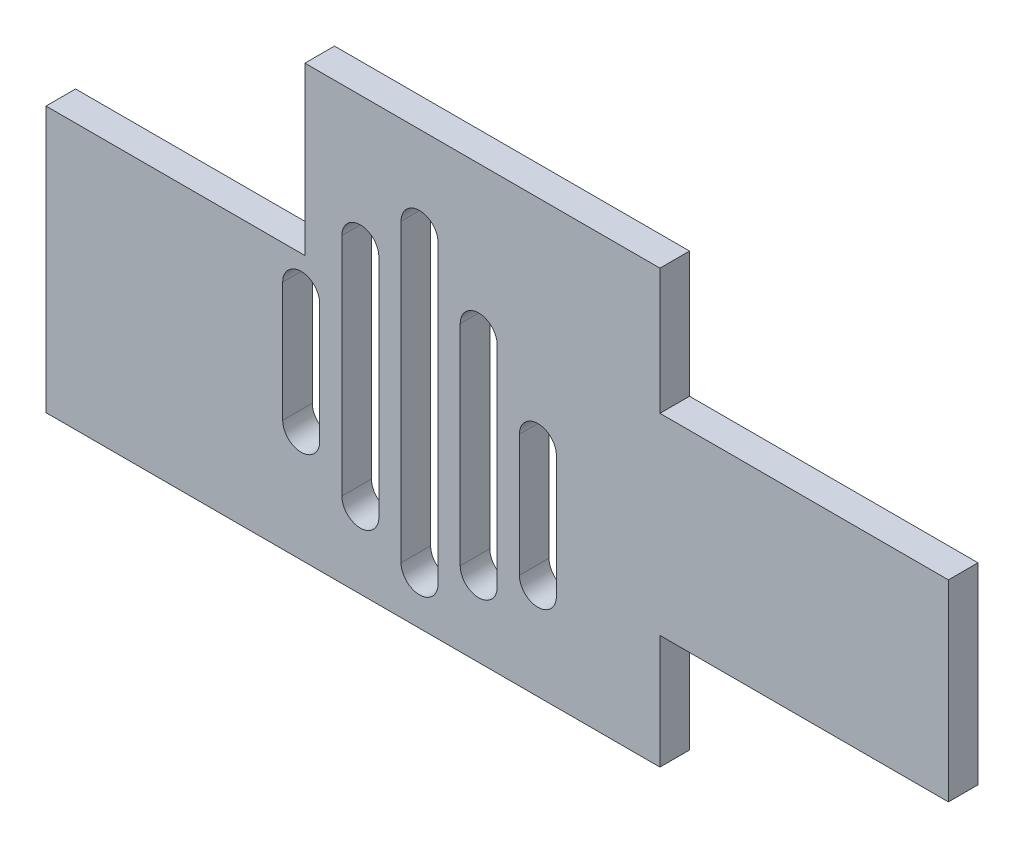
from build123d import *

# Parameters (mm, degrees)
BOSS_EXTRUDE1_DEPTH = 4


with BuildPart() as part:
    # Sketch1 → Boss-Extrude1 (new body)
    with BuildSketch(Plane.XY):
        Polygon((30.862718171, 33.994054131), (69.862718171, 33.994054131), (69.862718171, 7.994054131), (30.862718171, 7.994054131), (30.862718171, -7.430851064), (-52.137281829, -7.430851064), (-52.137281829, 28.472304637), (-17.137281829, 28.472304637), (-17.137281829, 50.994054131), (30.862718171, 50.994054131), align=None)
        with BuildLine():
            Line((-4.137281829, 38.994054131), (-4.137281829, -1.005945869))
            ThreePointArc((-4.137281829, -1.005945869), (-1.637281829, -3.505945869), (0.862718171, -1.005945869))
            Line((0.862718171, -1.005945869), (0.862718171, 38.994054131))
            ThreePointArc((0.862718171, 38.994054131), (-1.637281829, 41.494054131), (-4.137281829, 38.994054131))
        make_face(mode=Mode.SUBTRACT)
        with BuildLine():
            Line((-12.137281829, 33.312431903), (-12.137281829, 2.809827896))
            ThreePointArc((-12.137281829, 2.809827896), (-9.637281829, 0.309827896), (-7.137281829, 2.809827896))
            Line((-7.137281829, 2.809827896), (-7.137281829, 33.312431903))
            ThreePointArc((-7.137281829, 33.312431903), (-9.637281829, 35.812431903), (-12.137281829, 33.312431903))
        make_face(mode=Mode.SUBTRACT)
        with BuildLine():
            Line((-15.137281829, 23.861283589), (-15.137281829, 7.683449462))
            ThreePointArc((-15.137281829, 7.683449462), (-17.637281829, 5.183449462), (-20.137281829, 7.683449462))
            Line((-20.137281829, 7.683449462), (-20.137281829, 23.861283589))
            ThreePointArc((-20.137281829, 23.861283589), (-17.637281829, 26.361283589), (-15.137281829, 23.861283589))
        make_face(mode=Mode.SUBTRACT)
        with BuildLine():
            Line((3.862718171, 30.994054131), (3.862718171, 2.647434443))
            ThreePointArc((3.862718171, 2.647434443), (6.362718171, 0.147434443), (8.862718171, 2.647434443))
            Line((8.862718171, 2.647434443), (8.862718171, 30.994054131))
            ThreePointArc((8.862718171, 30.994054131), (6.362718171, 33.494054131), (3.862718171, 30.994054131))
        make_face(mode=Mode.SUBTRACT)
        with BuildLine():
            Line((11.862718171, 22.048271006), (11.862718171, 5.538473012))
            ThreePointArc((11.862718171, 5.538473012), (14.362718171, 3.038473012), (16.862718171, 5.538473012))
            Line((16.862718171, 5.538473012), (16.862718171, 22.048271006))
            ThreePointArc((16.862718171, 22.048271006), (14.362718171, 24.548271006), (11.862718171, 22.048271006))
        make_face(mode=Mode.SUBTRACT)
    extrude(amount=BOSS_EXTRUDE1_DEPTH)


solid = part.part
